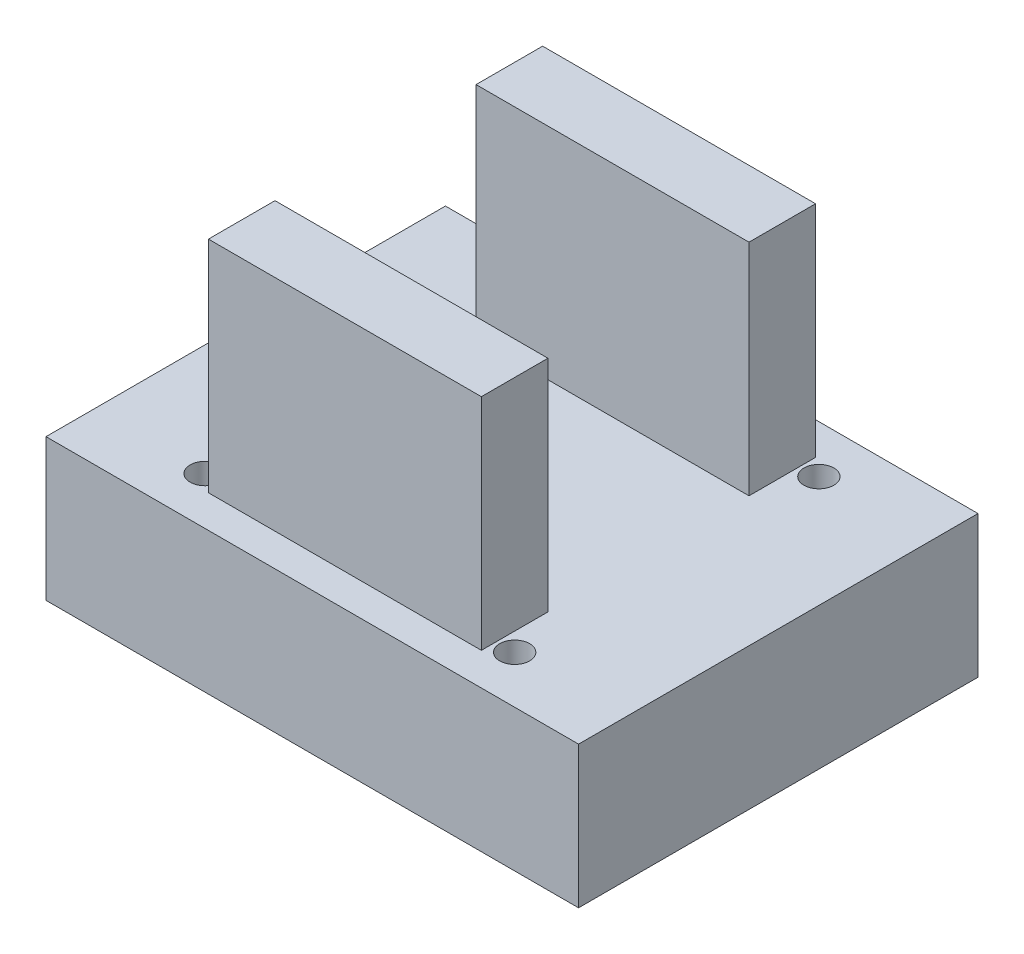
from build123d import *

# Parameters (mm, degrees)
SKETCH1_W           = 20.32
SKETCH1_H           = 15.24
BOSS_EXTRUDE1_DEPTH = 5.4102
SKETCH2_W           = 10.414
SKETCH2_H           = 2.54
BOSS_EXTRUDE2_DEPTH = 8.382
SKETCH3_R           = 0.5715
CUT_EXTRUDE1_DEPTH  = 5.4102


with BuildPart() as part:
    # Sketch1 → Boss-Extrude1 (new body)
    with BuildSketch(Plane(origin=(0, 0, 0), x_dir=(1, 0, 0), z_dir=(0, 1, 0))):
        with Locations((10.16, 7.62)):
            Rectangle(SKETCH1_W, SKETCH1_H)
    extrude(amount=BOSS_EXTRUDE1_DEPTH)

    # Sketch2 → Boss-Extrude2 (add)
    with BuildSketch(Plane(origin=(0, 5.4102, 0), x_dir=(1, 0, 0), z_dir=(0, 1, 0))):
        with Locations((10.16, 12.7254)):
            Rectangle(SKETCH2_W, SKETCH2_H)
        with Locations((10.16, 2.5146)):
            Rectangle(SKETCH2_W, SKETCH2_H)
    extrude(amount=BOSS_EXTRUDE2_DEPTH)

    # Sketch3 → Cut-Extrude1 (cut)
    with BuildSketch(Plane.XZ):
        with Locations(Location((4.2545, -1.8161, 0), (0, 0, 270))):
            Circle(SKETCH3_R)
        with Locations(Location((16.0655, -1.8161, 0), (0, 0, 270))):
            Circle(SKETCH3_R)
        with Locations(Location((16.0655, -13.4239, 0), (0, 0, 270))):
            Circle(SKETCH3_R)
        with Locations(Location((4.2545, -13.4239, 0), (0, 0, 270))):
            Circle(SKETCH3_R)
    extrude(amount=-CUT_EXTRUDE1_DEPTH, mode=Mode.SUBTRACT)


solid = part.part
